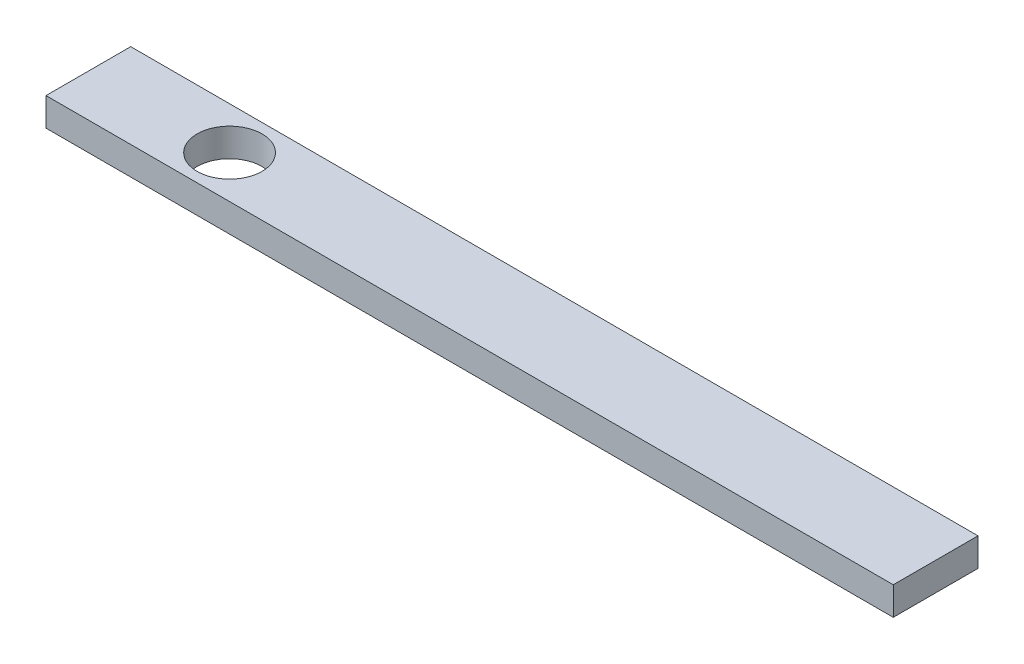
from build123d import *

# Parameters (mm, degrees)
SKETCH1_W           = 76.2
SKETCH1_H           = 7.62
SKETCH1_R           = 2.921
BOSS_EXTRUDE1_DEPTH = 2.54


with BuildPart() as part:
    # Sketch1 → Boss-Extrude1 (new body)
    with BuildSketch(Plane(origin=(0, 0, 0), x_dir=(1, 0, 0), z_dir=(0, 1, 0))):
        with Locations((38.1, 3.81)):
            Rectangle(SKETCH1_W, SKETCH1_H)
        with Locations(Location((12.7, 3.81, 0), (0, 0, 90))):
            Circle(SKETCH1_R, mode=Mode.SUBTRACT)
    extrude(amount=BOSS_EXTRUDE1_DEPTH)


solid = part.part
